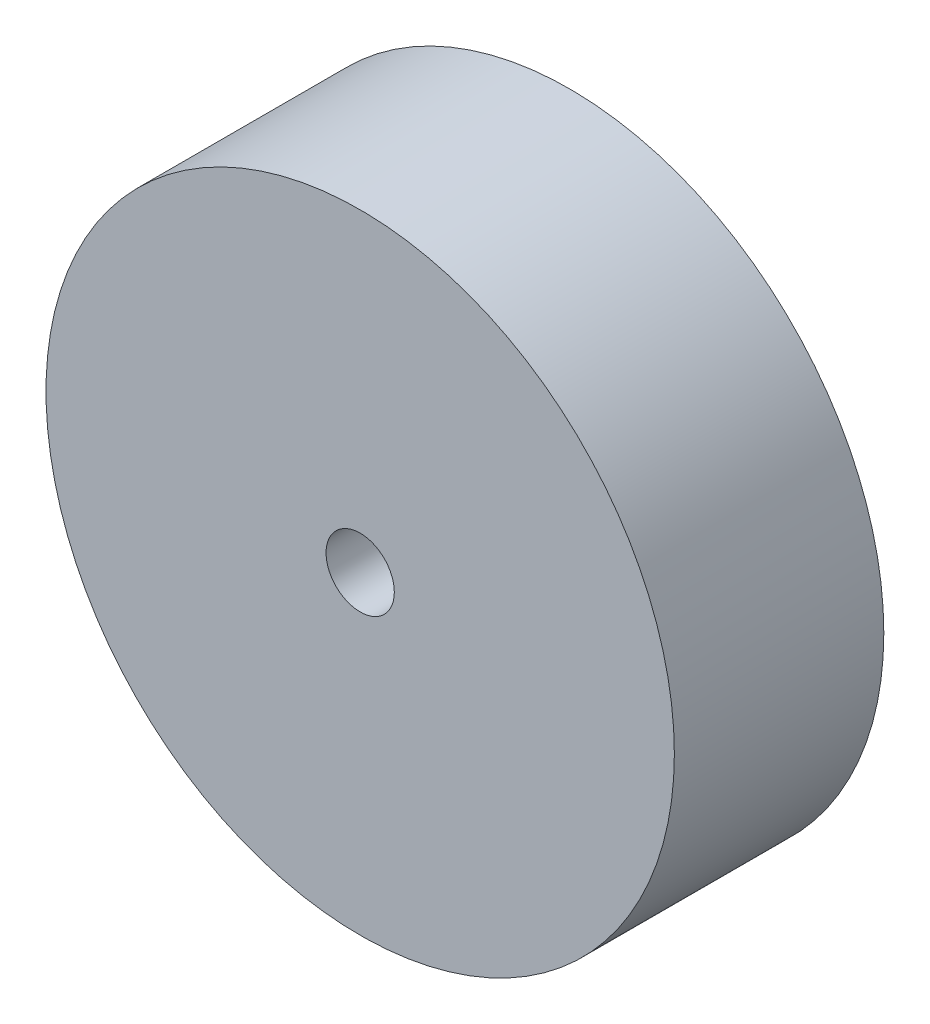
from build123d import *

# Parameters (mm, degrees)
SKETCH1_R           = 7.5
SKETCH1_R_2         = 0.815
BOSS_EXTRUDE1_DEPTH = 5


with BuildPart() as part:
    # Sketch1 → Boss-Extrude1 (new body)
    with BuildSketch(Plane.XY):
        Circle(SKETCH1_R)
        Circle(SKETCH1_R_2, mode=Mode.SUBTRACT)
    extrude(amount=BOSS_EXTRUDE1_DEPTH)


solid = part.part
